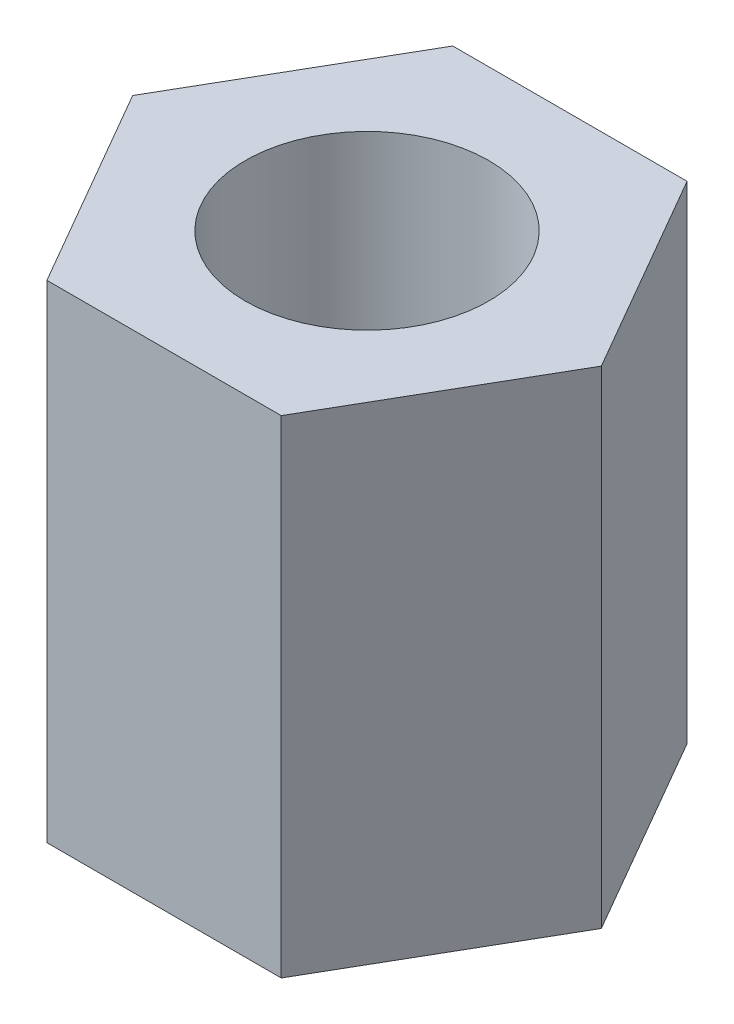
from build123d import *

# Parameters (mm, degrees)
CROQUIS1_R              = 1.5
SALIENTE_EXTRUIR1_DEPTH = 3


with BuildPart() as part:
    # Croquis1 → Saliente-Extruir1 (new, symmetric)
    with BuildSketch(Plane(origin=(0, 0, 0), x_dir=(1, 0, 0), z_dir=(0, 1, 0))):
        Polygon((1.443375673, -2.5), (2.886751346, 0), (1.443375673, 2.5), (-1.443375673, 2.5), (-2.886751346, 0), (-1.443375673, -2.5), align=None)
        with Locations(Location((0, 0, 0), (0, 0, 270))):
            Circle(CROQUIS1_R, mode=Mode.SUBTRACT)
    extrude(amount=SALIENTE_EXTRUIR1_DEPTH, both=True)


solid = part.part
